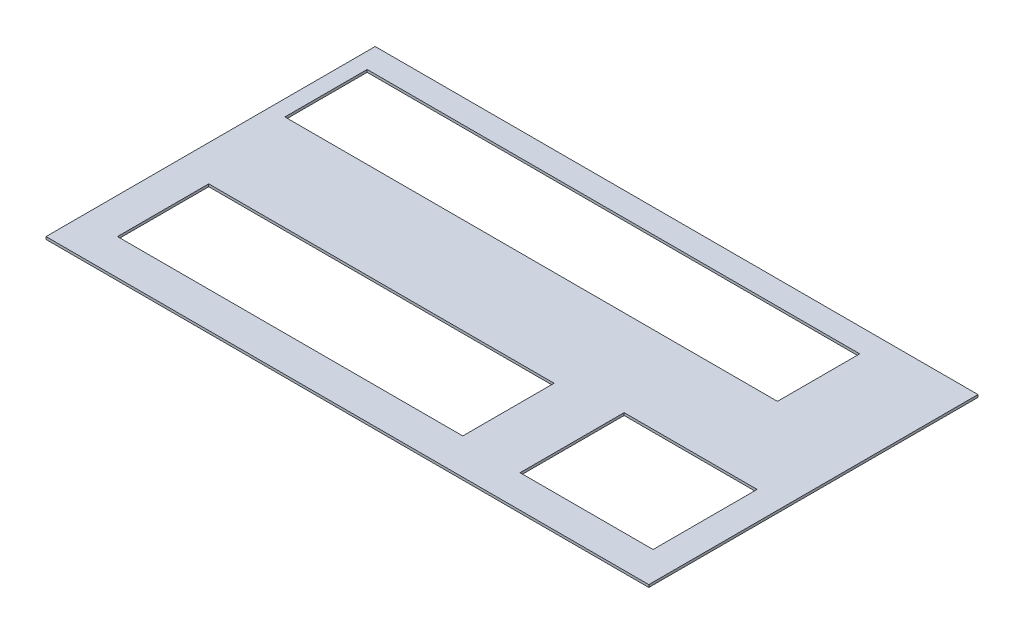
from build123d import *

# Parameters (mm, degrees)
SKETCH1_W           = 1518.68
SKETCH1_H           = 829.31
BOSS_EXTRUDE1_DEPTH = 6.35
CUT_EXTRUDE1_REACH  = 1732.371
SKETCH2_W           = 870
SKETCH2_H           = 230
SKETCH2_W_2         = 1240.954831331
SKETCH2_H_2         = 207.299090818
SKETCH2_W_3         = 335.086201595
SKETCH2_H_3         = 262.200219892


with BuildPart() as part:
    # Sketch1 → Boss-Extrude1 (new body)
    with BuildSketch(Plane(origin=(0, 0, 0), x_dir=(1, 0, 0), z_dir=(0, 1, 0))):
        with Locations((759.34, 414.655)):
            Rectangle(SKETCH1_W, SKETCH1_H)
    extrude(amount=BOSS_EXTRUDE1_DEPTH)

    # Sketch2 → Cut-Extrude1 (cut, up to next)
    with BuildSketch(Plane(origin=(0, 6.35, 0), x_dir=(1, 0, 0), z_dir=(0, 1, 0)), mode=Mode.PRIVATE) as cut_extrude1_sk1:
        with Locations((525, 205)):
            Rectangle(SKETCH2_W, SKETCH2_H)
    cut_extrude1_tool1 = extrude(cut_extrude1_sk1.sketch, amount=-CUT_EXTRUDE1_REACH, mode=Mode.PRIVATE) & part.part
    # Sketch2 → Cut-Extrude1 (cut, up to next)
    with BuildSketch(Plane(origin=(0, 6.35, 0), x_dir=(1, 0, 0), z_dir=(0, 1, 0)), mode=Mode.PRIVATE) as cut_extrude1_sk2:
        with Locations((660.423310547, 665.496365601)):
            Rectangle(SKETCH2_W_2, SKETCH2_H_2)
    cut_extrude1_tool2 = extrude(cut_extrude1_sk2.sketch, amount=-CUT_EXTRUDE1_REACH, mode=Mode.PRIVATE) & part.part
    # Sketch2 → Cut-Extrude1 (cut, up to next)
    with BuildSketch(Plane(origin=(0, 6.35, 0), x_dir=(1, 0, 0), z_dir=(0, 1, 0)), mode=Mode.PRIVATE) as cut_extrude1_sk3:
        with Locations((1279.95415502, 213.035336328)):
            Rectangle(SKETCH2_W_3, SKETCH2_H_3)
    cut_extrude1_tool3 = extrude(cut_extrude1_sk3.sketch, amount=-CUT_EXTRUDE1_REACH, mode=Mode.PRIVATE) & part.part
    add(cut_extrude1_tool1.solids().sort_by_distance((525, 6.35, -205))[0], mode=Mode.SUBTRACT)
    add(cut_extrude1_tool2.solids().sort_by_distance((660.423311, 6.35, -665.496366))[0], mode=Mode.SUBTRACT)
    add(cut_extrude1_tool3.solids().sort_by_distance((1279.954155, 6.35, -213.035336))[0], mode=Mode.SUBTRACT)


solid = part.part
